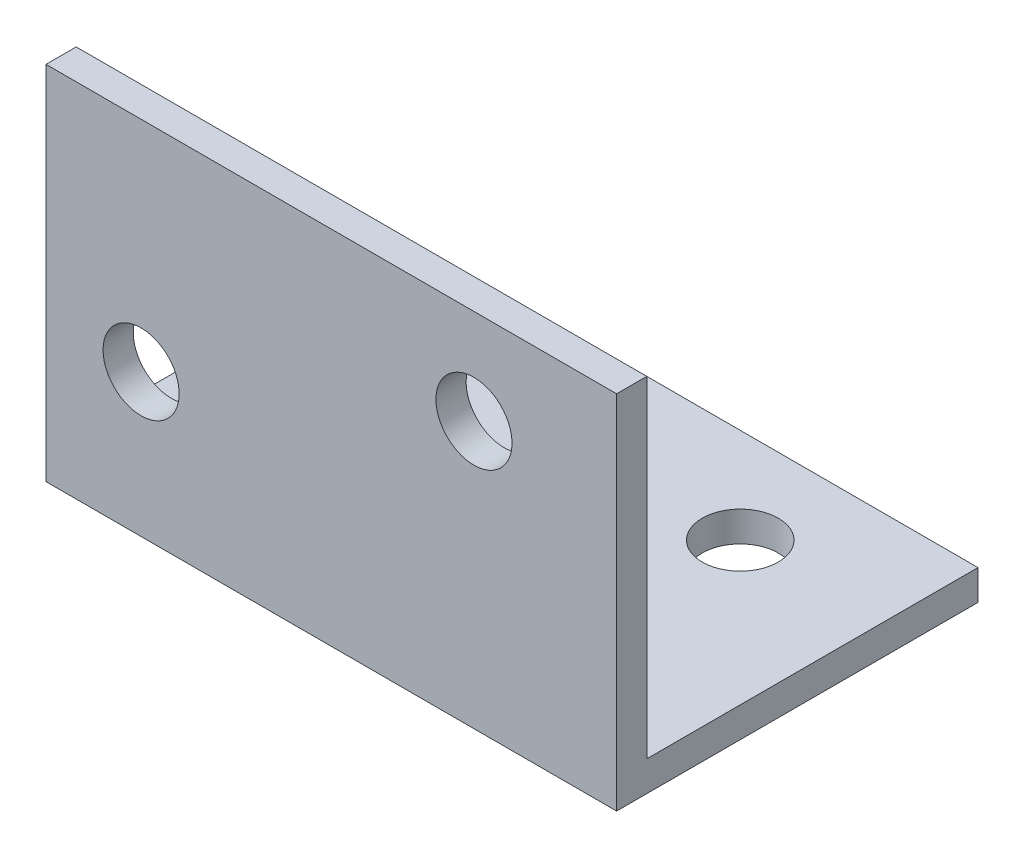
from build123d import *

# Parameters (mm, degrees)
SKETCH1_W           = 60
SKETCH1_H           = 38
BOSS_EXTRUDE1_DEPTH = 3.175
SKETCH2_W           = 60
SKETCH2_H           = 3.175
BOSS_EXTRUDE2_DEPTH = 34.825
SKETCH3_R           = 4
CUT_EXTRUDE1_DEPTH  = 80.099814317
SKETCH4_R           = 4
CUT_EXTRUDE2_DEPTH  = 78.624488726


with BuildPart() as part:
    # Sketch1 → Boss-Extrude1 (new body)
    with BuildSketch(Plane.XY):
        with Locations((30, 19)):
            Rectangle(SKETCH1_W, SKETCH1_H)
    extrude(amount=BOSS_EXTRUDE1_DEPTH)

    # Sketch2 → Boss-Extrude2 (add)
    with BuildSketch(Plane(origin=(0, 0, 0), x_dir=(-1, 0, 0), z_dir=(0, 0, -1))):
        with Locations((-30, 1.5875)):
            Rectangle(SKETCH2_W, SKETCH2_H)
    extrude(amount=BOSS_EXTRUDE2_DEPTH)

    # Sketch3 → Cut-Extrude1 (cut, through all)
    with BuildSketch(Plane(origin=(0, 0, 0), x_dir=(-1, 0, 0), z_dir=(0, 0, -1))):
        with Locations((-45, 28)):
            Circle(SKETCH3_R)
        with Locations((-10, 15)):
            Circle(SKETCH3_R)
    extrude(amount=-CUT_EXTRUDE1_DEPTH, mode=Mode.SUBTRACT)

    # Sketch4 → Cut-Extrude2 (cut, through all)
    with BuildSketch(Plane(origin=(0, 3.175, 0), x_dir=(1, 0, 0), z_dir=(0, 1, 0))):
        with Locations(Location((45, 24.825, 0), (0, 0, 180))):
            Circle(SKETCH4_R)
        with Locations(Location((10, 11.825, 0), (0, 0, 180))):
            Circle(SKETCH4_R)
    extrude(amount=-CUT_EXTRUDE2_DEPTH, mode=Mode.SUBTRACT)


solid = part.part
